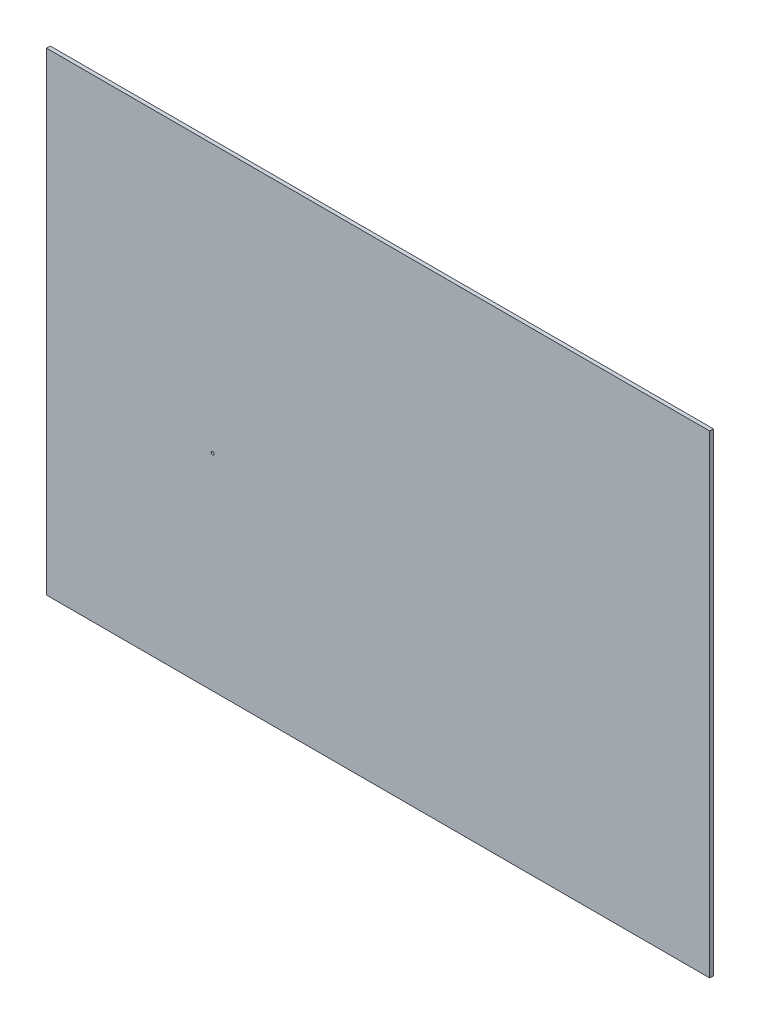
from build123d import *

# Parameters (mm, degrees)
SKETCH_1_W          = 70
SKETCH_1_H          = 50
BOARD_DEPTH         = 0.39116
SKETCH_2_R          = 0.15
CUT_EXTRUDE_1_DEPTH = 0.39116


with BuildPart() as part:
    # Эскиз1 → Board (new body)
    with BuildSketch(Plane.XY):
        with Locations((60.4, 50.4)):
            Rectangle(SKETCH_1_W, SKETCH_1_H)
    extrude(amount=BOARD_DEPTH)

    # Эскиз2 → Вырез-Вытянуть1 (cut)
    with BuildSketch(Plane.XY.offset(0.39116)):
        with Locations((42.926, 47.128)):
            Circle(SKETCH_2_R)
    extrude(amount=-CUT_EXTRUDE_1_DEPTH, mode=Mode.SUBTRACT)


solid = part.part
